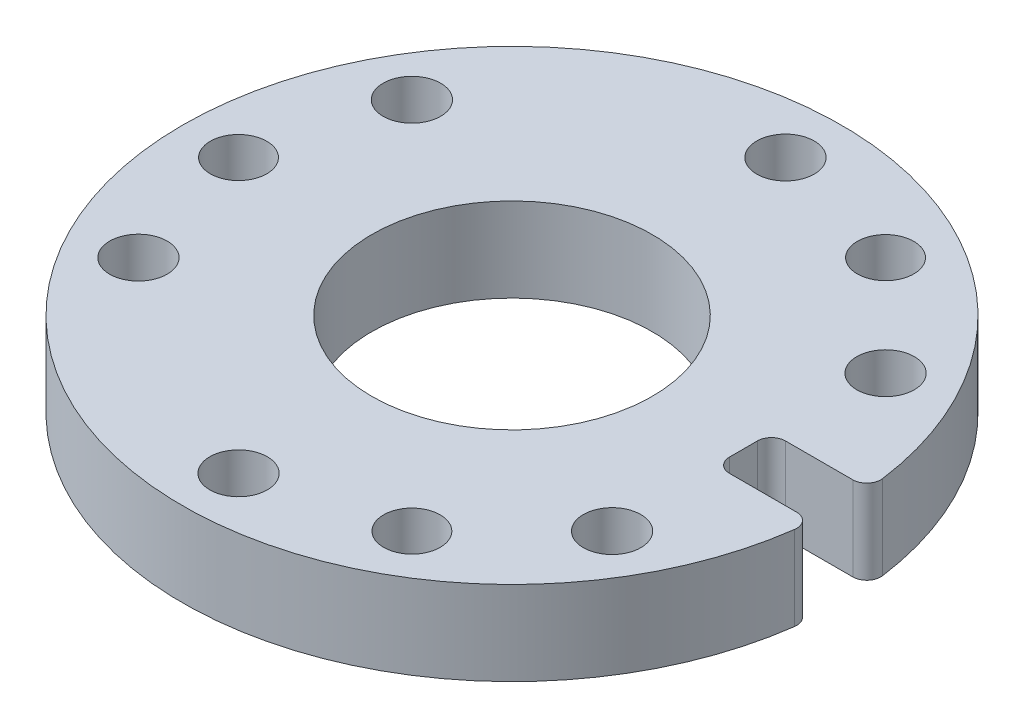
from build123d import *

# Parameters (mm, degrees)
SKETCH_1_R          = 23.5
SKETCH_1_R_2        = 10
SKETCH_1_R_3        = 2.05
SKETCH_1_R_4        = 2.015
EXTRUDE_1_DEPTH     = 6
SKETCH_2_W          = 12.240085516
SKETCH_2_H          = 4
CUT_EXTRUDE_1_DEPTH = 10
FILLET_1_R          = 1


with BuildPart() as part:
    # 草图1 → 凸台-拉伸1 (new body)
    with BuildSketch(Plane(origin=(0, 0, 0), x_dir=(1, 0, 0), z_dir=(0, 1, 0))):
        with Locations(Location((0, 0, 0), (0, 0, 270))):
            Circle(SKETCH_1_R)
        with Locations(Location((0, 0, 0), (0, 0, 270))):
            Circle(SKETCH_1_R_2, mode=Mode.SUBTRACT)
        with Locations(Location((0, 19.5, 0), (0, 0, 270))):
            Circle(SKETCH_1_R_3, mode=Mode.SUBTRACT)
        with Locations(Location((16.887495374, 9.75, 0), (0, 0, 270))):
            Circle(SKETCH_1_R_3, mode=Mode.SUBTRACT)
        with Locations(Location((16.887495374, -9.75, 0), (0, 0, 270))):
            Circle(SKETCH_1_R_3, mode=Mode.SUBTRACT)
        with Locations(Location((0, -19.5, 0), (0, 0, 270))):
            Circle(SKETCH_1_R_3, mode=Mode.SUBTRACT)
        with Locations(Location((-16.887495374, -9.75, 0), (0, 0, 270))):
            Circle(SKETCH_1_R_3, mode=Mode.SUBTRACT)
        with Locations(Location((-16.887495374, 9.75, 0), (0, 0, 270))):
            Circle(SKETCH_1_R_3, mode=Mode.SUBTRACT)
        with Locations(Location((-19.5, 0, 0), (0, 0, 270))):
            Circle(SKETCH_1_R_4, mode=Mode.SUBTRACT)
        with Locations(Location((9.75, 16.887495374, 0), (0, 0, 270))):
            Circle(SKETCH_1_R_4, mode=Mode.SUBTRACT)
        with Locations(Location((9.75, -16.887495374, 0), (0, 0, 270))):
            Circle(SKETCH_1_R_4, mode=Mode.SUBTRACT)
    extrude(amount=EXTRUDE_1_DEPTH)

    # 草图2 → 切除-拉伸1 (cut)
    with BuildSketch(Plane(origin=(0, 6, 0), x_dir=(1, 0, 0), z_dir=(0, 1, 0))):
        with Locations((22.620042758, 0)):
            Rectangle(SKETCH_2_W, SKETCH_2_H)
    extrude(amount=-CUT_EXTRUDE_1_DEPTH, mode=Mode.SUBTRACT)

    # 圆角1
    fillet_1_edges = [part.edges().sort_by_distance(p)[0] for p in [
        (23.414738948, 3, 2),
        (23.414738948, 3, -2),
        (16.5, 3, 2),
        (16.5, 3, -2),
    ]]
    fillet(fillet_1_edges, radius=FILLET_1_R)


solid = part.part
